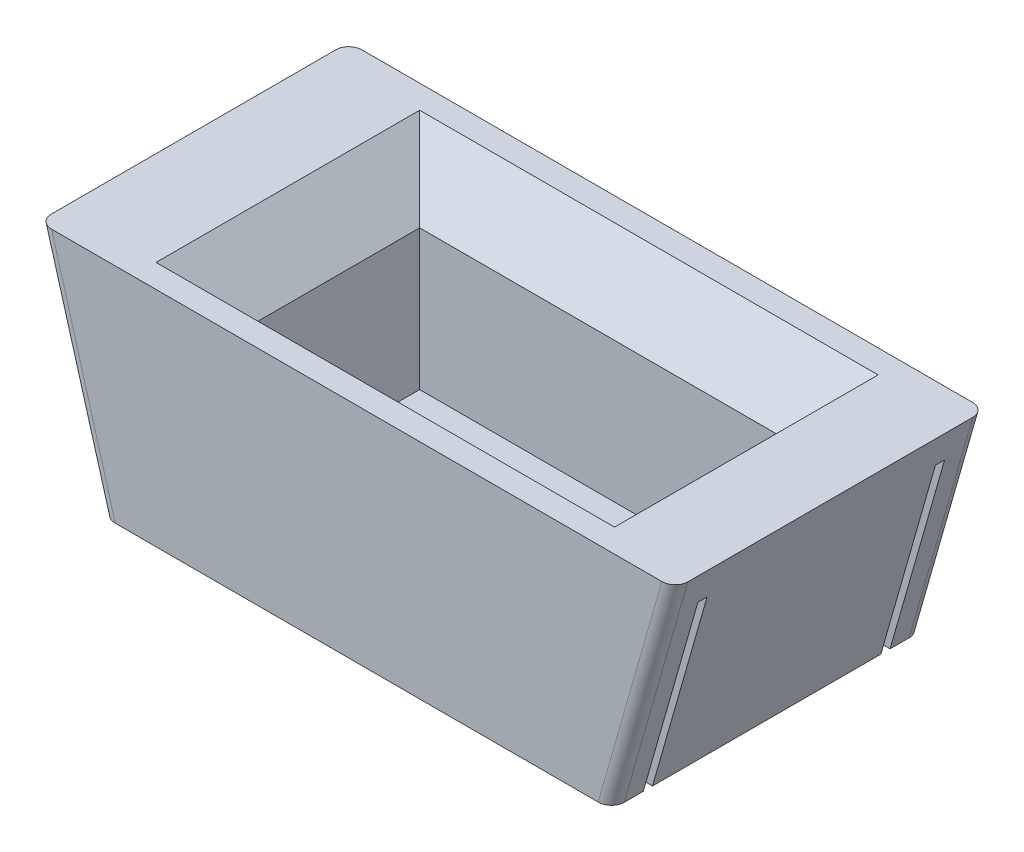
from build123d import *

# Parameters (mm, degrees)
SKETCH1_W           = 127
SKETCH1_H           = 61.9252
BOSS_EXTRUDE1_DEPTH = 44.45
SKETCH1_3_W         = 127
SKETCH1_3_H         = 1.8415
CUT_EXTRUDE2_DEPTH  = 38.1
SKETCH2_W           = 71.12
SKETCH2_H           = 32.258
SKETCH2_W_2         = 35.442647017
SKETCH2_H_2         = 23.182829488
CUT_EXTRUDE3_DEPTH  = 38.1
CHAMFER2_SIZE       = 10.16
CUT_EXTRUDE5_DEPTH  = 100.210800294
FILLET3_R           = 2.54
SKETCH2_3_W         = 35.442647017
SKETCH2_3_H         = 23.182829488
CUT_EXTRUDE6_DEPTH  = 84.466970107
CHAMFER3_SIZE       = 2.54


with BuildPart() as part:
    # Sketch1 → Boss-Extrude1 (new body)
    with BuildSketch(Plane(origin=(0, 0, 0), x_dir=(1, 0, 0), z_dir=(0, 1, 0))):
        Rectangle(SKETCH1_W, SKETCH1_H)
    extrude(amount=BOSS_EXTRUDE1_DEPTH)

    # Sketch1<3> → Cut-Extrude2 (cut)
    with BuildSketch(Plane(origin=(0, 0, 0), x_dir=(1, 0, 0), z_dir=(0, 1, 0))):
        with Locations((0, -23.69185)):
            Rectangle(SKETCH1_3_W, SKETCH1_3_H)
        with Locations((0, 23.69185)):
            Rectangle(SKETCH1_3_W, SKETCH1_3_H)
    extrude(amount=CUT_EXTRUDE2_DEPTH, mode=Mode.SUBTRACT)

    # Sketch2 → Cut-Extrude3 (cut)
    with BuildSketch(Plane(origin=(0, 44.45, 0), x_dir=(1, 0, 0), z_dir=(0, 1, 0))):
        with Locations((1.016, 0)):
            Rectangle(SKETCH2_W, SKETCH2_H)
        with Locations((12.504676492, 0)):
            Rectangle(SKETCH2_W_2, SKETCH2_H_2, mode=Mode.SUBTRACT)
    extrude(amount=-CUT_EXTRUDE3_DEPTH, mode=Mode.SUBTRACT)

    # Chamfer2
    chamfer2_edges = [part.edges().sort_by_distance(p)[0] for p in [
        (1.016, 44.45, 16.129),
        (1.016, 44.45, -16.129),
        (36.576, 44.45, 0),
        (-34.544, 44.45, 0),
    ]]
    chamfer(chamfer2_edges, length=CHAMFER2_SIZE)

    # Sketch7 → Cut-Extrude5 (cut, through all)
    with BuildSketch(Plane.XY.offset(30.9626)):
        Polygon((-50.795476794, 0), (-63.5, 44.45), (-63.5, 0), align=None)
        Polygon((63.5, 44.45), (50.795476794, 0), (63.5, 0), align=None)
    extrude(amount=-CUT_EXTRUDE5_DEPTH, mode=Mode.SUBTRACT)

    # Fillet3
    fillet3_edges = [part.edges().sort_by_distance(p)[0] for p in [
        (-57.147738397, 22.225, 30.9626),
        (-57.147738397, 22.225, -30.9626),
        (57.147738397, 22.225, -30.9626),
        (57.147738397, 22.225, 30.9626),
    ]]
    fillet(fillet3_edges, radius=FILLET3_R)

    # Sketch2<3> → Cut-Extrude6 (cut, through all)
    with BuildSketch(Plane(origin=(0, 44.45, 0), x_dir=(1, 0, 0), z_dir=(0, 1, 0))):
        with Locations((12.504676492, 0)):
            Rectangle(SKETCH2_3_W, SKETCH2_3_H)
    extrude(amount=-CUT_EXTRUDE6_DEPTH, mode=Mode.SUBTRACT)

    # Chamfer3
    chamfer3_edges = [part.edges().sort_by_distance(p)[0] for p in [
        (12.504676491, 0, 11.591414744),
        (-5.216647017, 0, 0),
        (30.226, 0, 0),
        (12.504676491, 0, -11.591414744),
    ]]
    chamfer(chamfer3_edges, length=CHAMFER3_SIZE)


solid = part.part
